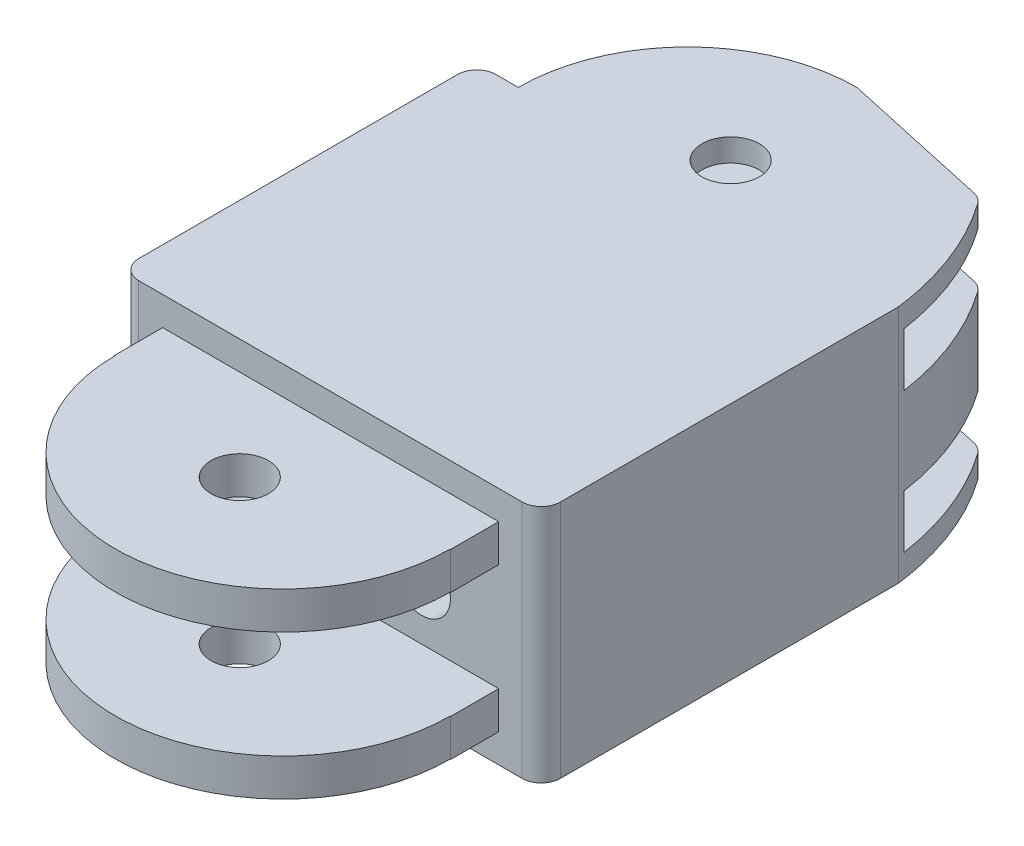
from build123d import *

# Parameters (mm, degrees)
SKETCH2_W             = 17.554431489
SKETCH2_H             = 1.95
BOSS_EXTRUDE1_DEPTH   = 8.75
BOSS_EXTRUDE1_2_DEPTH = 8.75
CUT_EXTRUDE1_DEPTH    = 26.518349076
SKETCH4_W             = 22.027215745
SKETCH4_H             = 12.505427167
BOSS_EXTRUDE2_DEPTH   = 30
SKETCH5_R             = 1.5
CUT_EXTRUDE2_DEPTH    = 12
SKETCH6_W             = 22.027215745
SKETCH6_H             = 12.505427167
SKETCH6_W_2           = 17.554431489
SKETCH6_H_2           = 1.95
CUT_EXTRUDE3_DEPTH    = 2.5
SKETCH7_R             = 1.5
CUT_EXTRUDE4_DEPTH    = 13
SKETCH8_R             = 1.5
CUT_EXTRUDE5_DEPTH    = 28
FILLET3_R             = 1
SKETCH9_W             = 22.022981174
SKETCH9_H             = 2.796352896
SKETCH9_H_2           = 2.782097604
CUT_EXTRUDE6_DEPTH    = 11
SKETCH10_W            = 17.952287352
SKETCH10_H            = 2.796352896
SKETCH10_H_2          = 2.782097604
CUT_EXTRUDE7_DEPTH    = 5


with BuildPart() as part:
    # Sketch2 → Boss-Extrude1 (new body)
    with BuildSketch(Plane.XY):
        with Locations((-13.228930986, -27.845183414)):
            Rectangle(SKETCH2_W, SKETCH2_H)
    extrude(amount=BOSS_EXTRUDE1_DEPTH)


with BuildPart() as body_2:
    # Sketch2 → Boss-Extrude1 2 (new body)
    with BuildSketch(Plane.XY):
        with Locations((-13.228930986, -20.289756247)):
            Rectangle(SKETCH2_W, SKETCH2_H)
    extrude(amount=BOSS_EXTRUDE1_2_DEPTH)


with BuildPart() as cut_extrude1_tool:
    # Sketch3 → Cut-Extrude1 (new, through all)
    with BuildSketch(Plane(origin=(0, -19.314756247, 0), x_dir=(1, 0, 0), z_dir=(0, 1, 0))):
        with BuildLine():
            ThreePointArc((-13.228930986, -8.75), (-7.041746651, -6.187184335), (-4.478930986, 0))
            add(Edge.make_bspline(
                [(-4.478930986, 0), (1.138349918, -4.151657709), (-4.451715242, -8.75)],
                knots=[0, 0, 0, 1, 1, 1], degree=2))
            add(Edge.make_bspline(
                [(-22.006146731, -8.75), (-13.228930986, -12.473510392), (-4.451715242, -8.75)],
                knots=[0, 0, 0, 1, 1, 1], degree=2))
            add(Edge.make_bspline(
                [(-21.978930986, 0), (-25.926969228, -4.242865138), (-22.006146731, -8.75)],
                knots=[0, 0, 0, 1, 1, 1], degree=2))
            ThreePointArc((-21.978930986, 0), (-19.416115322, -6.187184335), (-13.228930986, -8.75))
        make_face()
    extrude(amount=-CUT_EXTRUDE1_DEPTH)


with BuildPart() as part_1:
    add(part.part)

    # Cut-Extrude1: cut by cut_extrude1_tool
    add(cut_extrude1_tool.part, mode=Mode.SUBTRACT)



with BuildPart() as body_2_1:
    add(body_2.part)

    # Cut-Extrude1: cut by cut_extrude1_tool
    add(cut_extrude1_tool.part, mode=Mode.SUBTRACT)


with BuildPart() as part_2:
    add(part_1.part)

    add(body_2_1.part)  # Boss-Extrude2 merges body 2
    # Sketch4 → Boss-Extrude2 (add)
    with BuildSketch(Plane(origin=(0, 0, 0), x_dir=(-1, 0, 0), z_dir=(0, 0, -1))):
        with Locations((13.242538859, -24.067469831)):
            Rectangle(SKETCH4_W, SKETCH4_H)
    extrude(amount=BOSS_EXTRUDE2_DEPTH)

    # Sketch5 → Cut-Extrude2 (cut)
    with BuildSketch(Plane(origin=(0, -19.314756247, 0), x_dir=(1, 0, 0), z_dir=(0, 1, 0))):
        with Locations(Location((-13.228930986, -2.25, 0), (0, 0, 270))):
            Circle(SKETCH5_R)
    extrude(amount=-CUT_EXTRUDE2_DEPTH, mode=Mode.SUBTRACT)

    # Sketch6 → Cut-Extrude3 (cut)
    with BuildSketch(Plane.XY):
        with Locations((-13.242538859, -24.067469831)):
            Rectangle(SKETCH6_W, SKETCH6_H)
        with Locations((-13.228930986, -27.845183414)):
            Rectangle(SKETCH6_W_2, SKETCH6_H_2, mode=Mode.SUBTRACT)
        with Locations((-13.228930986, -20.289756247)):
            Rectangle(SKETCH6_W_2, SKETCH6_H_2, mode=Mode.SUBTRACT)
    extrude(amount=-CUT_EXTRUDE3_DEPTH, mode=Mode.SUBTRACT)

    # Sketch7 → Cut-Extrude4 (cut)
    with BuildSketch(Plane(origin=(0, -17.814756247, 0), x_dir=(1, 0, 0), z_dir=(0, 1, 0))):
        with Locations(Location((-13.242538859, 23.405672985, 0), (0, 0, 270))):
            Circle(SKETCH7_R)
        with BuildLine():
            Line((-22.086865874, 21.155672985), (-24.256146731, 21.155672985))
            add(Edge.make_bspline(
                [(-2.228930986, 21.155672985), (11.471530889, 27.189710441), (-11.765166974, 53.431279988), (-37.007876173, 21.523583672), (-24.256146731, 21.155672985)],
                knots=[0, 0, 0, 0, 0.52011282, 1, 1, 1, 1], degree=3))
            add(Edge.make_bspline(
                [(-5.046294073, 28.201654423), (-2.731488374, 25.068620188), (-2.228930986, 21.155672985)],
                knots=[0, 0, 0, 1, 1, 1], degree=2))
            Line((-5.046294073, 28.201654423), (-13.242538859, 30))
            ThreePointArc((-13.242538859, 30), (-19.496422466, 27.409556592), (-22.086865874, 21.155672985))
        make_face()
    extrude(amount=-CUT_EXTRUDE4_DEPTH, mode=Mode.SUBTRACT)

    # Sketch8 → Cut-Extrude5 (cut)
    with BuildSketch(Plane.XY.offset(-2.5)):
        with Locations((-18.011106811, -24.06746983)):
            Circle(SKETCH8_R)
        with Locations((-8.473970906, -24.06746983)):
            Circle(SKETCH8_R)
    extrude(amount=-CUT_EXTRUDE5_DEPTH, mode=Mode.SUBTRACT)

    # Fillet3
    fillet3_edges = [part_2.edges().sort_by_distance(p)[0] for p in [
        (-24.256146731, -24.06746983, -2.5),
        (-24.256146731, -24.06746983, -21.155672985),
        (-2.228930986, -24.06746983, -2.5),
        (-5.046294073, -24.06746983, -28.201654423),
    ]]
    fillet(fillet3_edges, radius=FILLET3_R)

    # Sketch9 → Cut-Extrude6 (cut)
    with BuildSketch(Plane.XY.offset(-32.5)):
        with Locations((-13.24253886, -20.400707387)):
            Rectangle(SKETCH9_W, SKETCH9_H)
        with Locations((-13.24253886, -27.727104636)):
            Rectangle(SKETCH9_W, SKETCH9_H_2)
    extrude(amount=CUT_EXTRUDE6_DEPTH, mode=Mode.SUBTRACT)

    # Sketch10 → Cut-Extrude7 (cut)
    with BuildSketch(Plane(origin=(0, 0, -21.5), x_dir=(-1, 0, 0), z_dir=(0, 0, -1))):
        with Locations((13.104016993, -20.400707387)):
            Rectangle(SKETCH10_W, SKETCH10_H)
        with Locations((13.104016993, -27.727104636)):
            Rectangle(SKETCH10_W, SKETCH10_H_2)
    extrude(amount=-CUT_EXTRUDE7_DEPTH, mode=Mode.SUBTRACT)


solid = part_2.part
